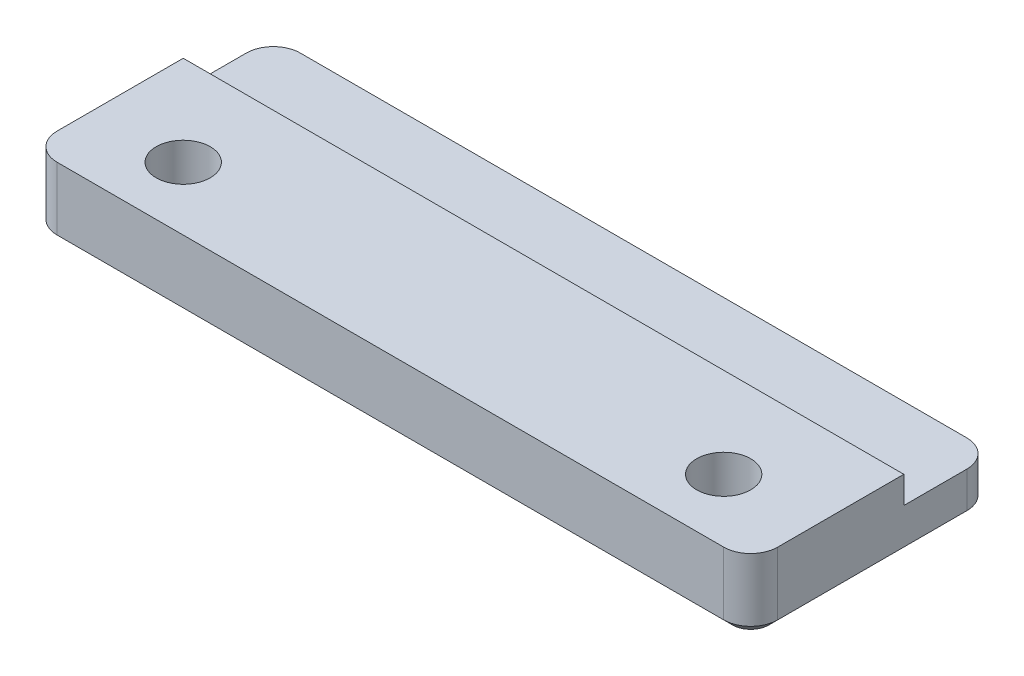
from build123d import *

# Parameters (mm, degrees)
SKETCH1_R           = 3
BOSS_EXTRUDE1_DEPTH = 8
SKETCH2_W           = 10
SKETCH2_H           = 3
CUT_EXTRUDE1_DEPTH  = 83.849260709
FILLET1_R           = 3
CHAMFER1_SIZE       = 1


with BuildPart() as part:
    # Sketch1 → Boss-Extrude1 (new body)
    with BuildSketch(Plane(origin=(0, 0, 0), x_dir=(1, 0, 0), z_dir=(0, 1, 0))):
        Polygon((-40, 20), (40, 20), (40, -7), (30, -7), (-40, -7), align=None)
        with Locations(Location((30, 0, 0), (0, 0, 270))):
            Circle(SKETCH1_R, mode=Mode.SUBTRACT)
        with Locations(Location((-30, 0, 0), (0, 0, 270))):
            Circle(SKETCH1_R, mode=Mode.SUBTRACT)
    extrude(amount=BOSS_EXTRUDE1_DEPTH)

    # Sketch2 → Cut-Extrude1 (cut, through all)
    with BuildSketch(Plane(origin=(40, 0, 0), x_dir=(0, 0, -1), z_dir=(1, 0, 0))):
        with Locations((15, 6.5)):
            Rectangle(SKETCH2_W, SKETCH2_H)
    extrude(amount=-CUT_EXTRUDE1_DEPTH, mode=Mode.SUBTRACT)

    # Fillet1
    fillet1_edges = [part.edges().sort_by_distance(p)[0] for p in [
        (-40, 4, 7),
        (40, 4, 7),
        (-40, 2.5, -20),
        (40, 2.5, -20),
    ]]
    fillet(fillet1_edges, radius=FILLET1_R)

    # Chamfer1
    chamfer1_edges = [part.edges().sort_by_distance(p)[0] for p in [
        (-40, 0, -6.5),
        (0, 0, 7),
        (0, 0, -20),
        (40, 0, -6.5),
        (39.121320344, 0, -19.121320344),
        (39.121320344, 0, 6.121320344),
        (-39.121320344, 0, 6.121320344),
        (-39.121320344, 0, -19.121320344),
        (-30, 0, -3),
        (30, 0, -3),
    ]]
    chamfer(chamfer1_edges, length=CHAMFER1_SIZE)


solid = part.part
